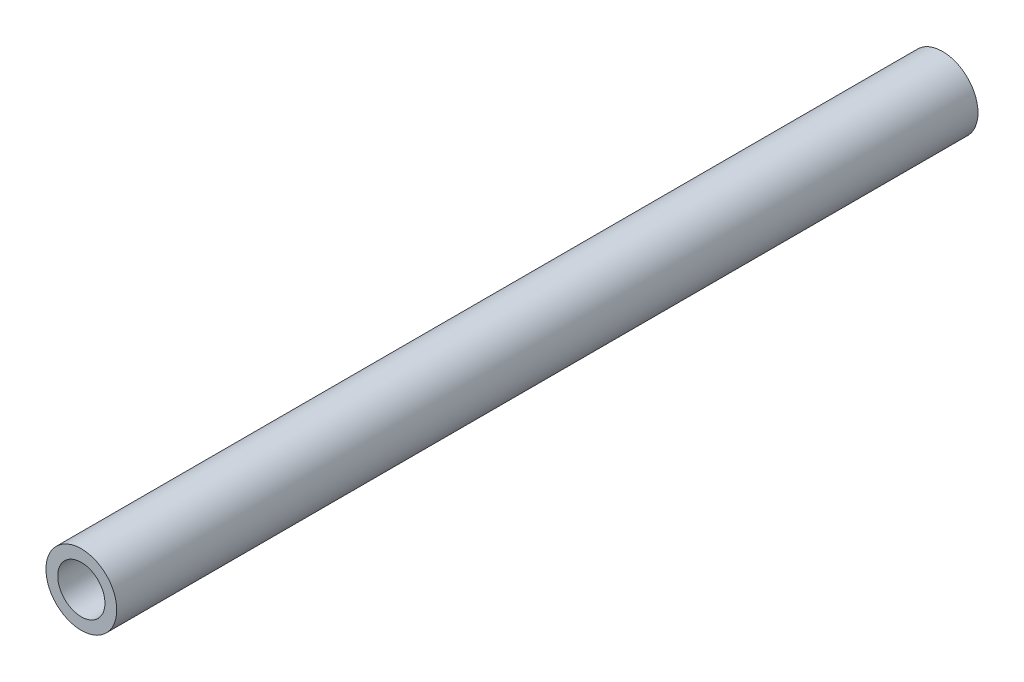
from build123d import *

# Parameters (mm, degrees)
MAIN_PROFILE_SKETCH_R   = 3
MAIN_PROFILE_SKETCH_R_2 = 2
MAIN_EXTRUSION_DEPTH    = 73


with BuildPart() as part:
    # Main Profile Sketch → Main Extrusion (new body)
    with BuildSketch(Plane.XY.offset(118)):
        with Locations((-90, 51.5)):
            Circle(MAIN_PROFILE_SKETCH_R)
        with Locations((-90, 51.5)):
            Circle(MAIN_PROFILE_SKETCH_R_2, mode=Mode.SUBTRACT)
    extrude(amount=-MAIN_EXTRUSION_DEPTH)


solid = part.part
